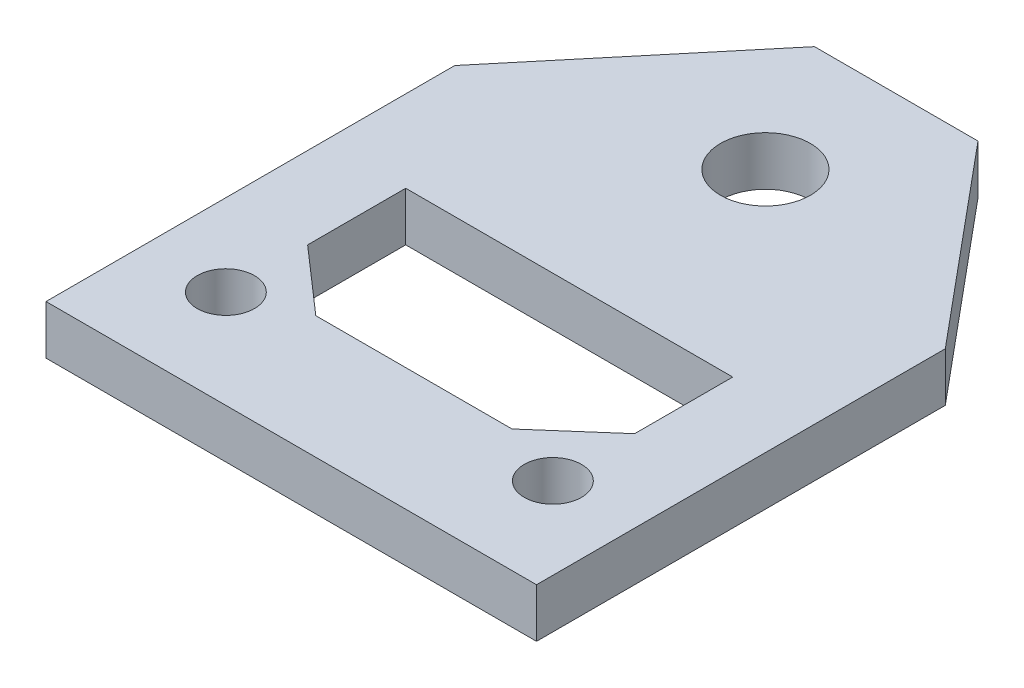
from build123d import *

# Parameters (mm, degrees)
SKETCH_2_R      = 1.75
SKETCH_2_R_2    = 2.75
EXTRUDE_2_DEPTH = 3


with BuildPart() as part:
    # 草图2 → 凸台-拉伸2 (new body)
    with BuildSketch(Plane(origin=(0, 0, 0), x_dir=(1, 0, 0), z_dir=(0, 1, 0))):
        Polygon((-15, 25), (-15, 0), (15, 0), (15, 25), (5, 37), (-5, 37), align=None)
        with Locations(Location((-10, 6, 0), (0, 0, 270))):
            Circle(SKETCH_2_R, mode=Mode.SUBTRACT)
        with Locations(Location((10, 6, 0), (0, 0, 270))):
            Circle(SKETCH_2_R, mode=Mode.SUBTRACT)
        with Locations(Location((0, 29, 0), (0, 0, 270))):
            Circle(SKETCH_2_R_2, mode=Mode.SUBTRACT)
        Polygon((-10, 17), (10, 17), (10, 11), (6, 7.5), (-6, 7.5), (-10, 11), align=None, mode=Mode.SUBTRACT)
    extrude(amount=-EXTRUDE_2_DEPTH)


solid = part.part
